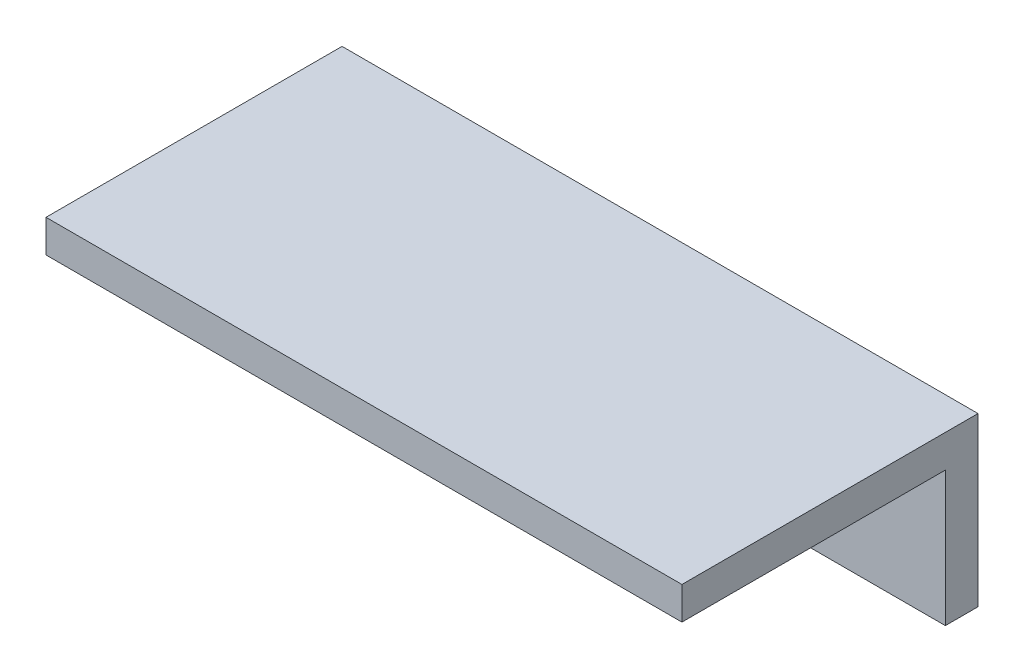
from build123d import *

# Parameters (mm, degrees)
SKETCH_1_W          = 68.2
SKETCH_1_H          = 17.95
EXTRUDE_1_DEPTH     = 3.5
SKETCH_21_W         = 68.2
SKETCH_21_H         = 3.5
EXTRUDE_4_DEPTH     = 28.25
SKETCH_24_R         = 2.85
CUT_EXTRUDE_2_DEPTH = 28.25


with BuildPart() as part:
    # 草圖1 → 1 (new body)
    with BuildSketch(Plane.XY):
        Rectangle(SKETCH_1_W, SKETCH_1_H)
    extrude(amount=EXTRUDE_1_DEPTH)

    # 草圖21 → 填料-伸長4 (add)
    with BuildSketch(Plane.XY.offset(3.5)):
        with Locations((0, 7.225)):
            Rectangle(SKETCH_21_W, SKETCH_21_H)
    extrude(amount=EXTRUDE_4_DEPTH)

    # 草圖24 → 除料-伸長2 (cut)
    with BuildSketch(Plane(origin=(0, 0, 0), x_dir=(-1, 0, 0), z_dir=(0, 0, -1))):
        with Locations((0, -3.070533486)):
            Circle(SKETCH_24_R)
    extrude(amount=-CUT_EXTRUDE_2_DEPTH, mode=Mode.SUBTRACT)


solid = part.part
